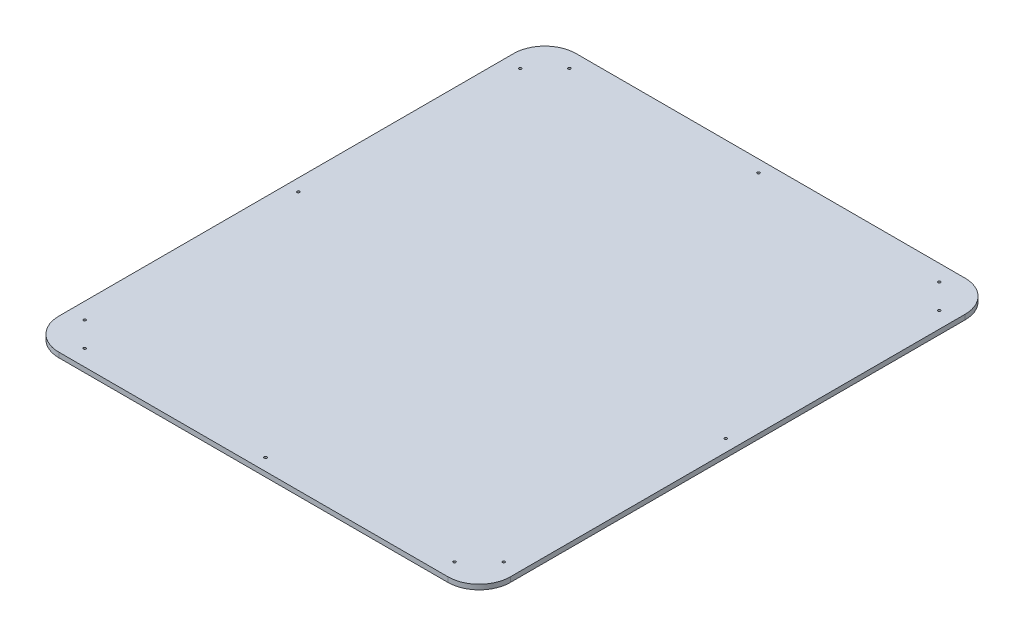
from build123d import *

# Parameters (mm, degrees)
CROQUIS1_W              = 550
CROQUIS1_H              = 630
SALIENTE_EXTRUIR1_DEPTH = 6
CROQUIS2_R              = 1.55
CORTAR_EXTRUIR1_DEPTH   = 6
REDONDEO1_R             = 38
CROQUIS3_R              = 1.6
CORTAR_EXTRUIR2_DEPTH   = 6


with BuildPart() as part:
    # Croquis1 → Saliente-Extruir1 (new body)
    with BuildSketch(Plane(origin=(0, 0, 0), x_dir=(1, 0, 0), z_dir=(0, 1, 0))):
        with Locations((275, 315)):
            Rectangle(CROQUIS1_W, CROQUIS1_H)
    extrude(amount=SALIENTE_EXTRUIR1_DEPTH)

    # Croquis2 → Cortar-Extruir1 (cut)
    with BuildSketch(Plane(origin=(0, 6, 0), x_dir=(1, 0, 0), z_dir=(0, 1, 0))):
        with Locations(Location((500.25, 610.25, 0), (0, 0, 270))):
            Circle(CROQUIS2_R)
        with Locations(Location((530.25, 580.25, 0), (0, 0, 270))):
            Circle(CROQUIS2_R)
        with Locations(Location((530.25, 49.75, 0), (0, 0, 270))):
            Circle(CROQUIS2_R)
        with Locations(Location((19.75, 580.25, 0), (0, 0, 90))):
            Circle(CROQUIS2_R)
        with Locations(Location((19.75, 49.75, 0), (0, 0, 90))):
            Circle(CROQUIS2_R)
        with Locations(Location((500.25, 19.75, 0), (0, 0, 270))):
            Circle(CROQUIS2_R)
        with Locations(Location((49.75, 610.25, 0), (0, 0, 90))):
            Circle(CROQUIS2_R)
        with Locations(Location((49.75, 19.75, 0), (0, 0, 90))):
            Circle(CROQUIS2_R)
    extrude(amount=-CORTAR_EXTRUIR1_DEPTH, mode=Mode.SUBTRACT)

    # Redondeo1
    redondeo1_edges = [part.edges().sort_by_distance(p)[0] for p in [
        (0, 3, -630),
        (550, 3, -630),
        (550, 3, 0),
        (0, 3, 0),
    ]]
    fillet(redondeo1_edges, radius=REDONDEO1_R)

    # Croquis3 → Cortar-Extruir2 (cut)
    with BuildSketch(Plane(origin=(0, 6, 0), x_dir=(1, 0, 0), z_dir=(0, 1, 0))):
        with Locations(Location((275, 615.25, 0), (0, 0, 270))):
            Circle(CROQUIS3_R)
        with Locations(Location((14.75, 315, 0), (0, 0, 270))):
            Circle(CROQUIS3_R)
        with Locations(Location((535.25, 315, 0), (0, 0, 270))):
            Circle(CROQUIS3_R)
        with Locations(Location((275, 14.75, 0), (0, 0, 270))):
            Circle(CROQUIS3_R)
    extrude(amount=-CORTAR_EXTRUIR2_DEPTH, mode=Mode.SUBTRACT)


solid = part.part
